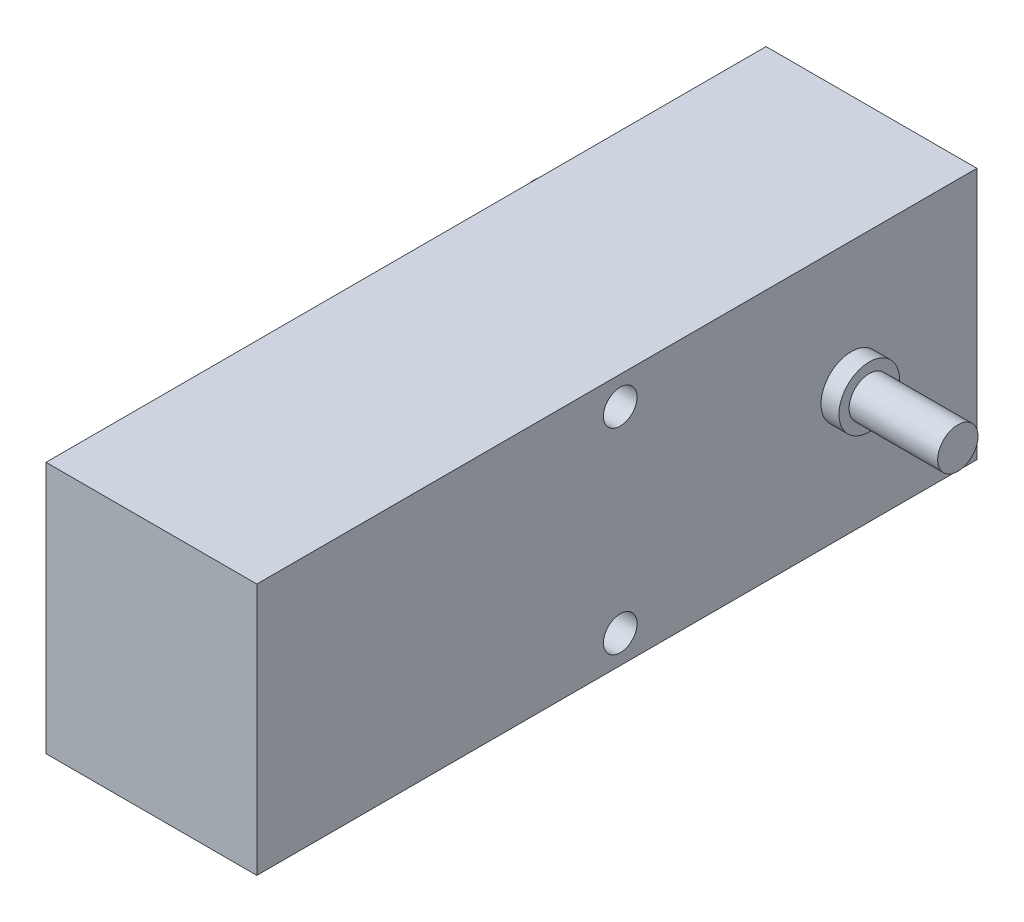
from build123d import *

# Parameters (mm, degrees)
SKETCH1_W               = 64.2
SKETCH1_H               = 22.5
BOSS_EXTRUDE1_DEPTH     = 9.4
SKETCH3_W               = 5
SKETCH3_H               = 5
SKETCH3_R               = 1.4
BOSS_EXTRUDE2_DEPTH     = 2.5
CUT_EXTRUDE1_DEPTH      = 44.129833063
CUT_EXTRUDE1_DEPTH_BACK = 44.129833063
SKETCH4_R               = 1.5


with BuildPart() as part:
    # Sketch1 → Boss-Extrude1 (new, symmetric)
    with BuildSketch(Plane(origin=(0, 0, 0), x_dir=(0, 0, -1), z_dir=(1, 0, 0))):
        Rectangle(SKETCH1_W, SKETCH1_H)
    extrude(amount=BOSS_EXTRUDE1_DEPTH, both=True)

    # Sketch2 → Revolve1 (revolve)
    with BuildSketch(Plane(origin=(0, 0, 0), x_dir=(1, 0, 0), z_dir=(0, 1, 0)), mode=Mode.PRIVATE) as revolve1_sk:
        Polygon((18.9, 20.9), (18.9, 22.7), (11, 22.7), (11, 23.6), (9.4, 23.6), (9.4, 20.9), align=None)
        Polygon((-9.4, 23.6), (-9.4, 20.9), (-18.9, 20.9), (-18.9, 22.7), (-11, 22.7), (-11, 23.6), align=None)
    revolve(revolve1_sk.sketch.rotate(Axis((0, 0, -20.9), (1, 0, 0)), 180), axis=Axis((0, 0, -20.9), (1, 0, 0)))

    # Sketch3 → Boss-Extrude2 (add, symmetric)
    with BuildSketch(Plane(origin=(0, 0, 0), x_dir=(0, 0, -1), z_dir=(1, 0, 0))):
        with Locations((34.6, 0)):
            Rectangle(SKETCH3_W, SKETCH3_H)
        with Locations((34.7, 0)):
            Circle(SKETCH3_R, mode=Mode.SUBTRACT)
    extrude(amount=BOSS_EXTRUDE2_DEPTH, both=True)

    # Sketch4 → Cut-Extrude1 (cut, two sides: drawn at the far end of the back side and taken through both)
    with BuildSketch(Plane(origin=(0, 0, 0), x_dir=(0, 0, -1), z_dir=(1, 0, 0)).offset(-CUT_EXTRUDE1_DEPTH_BACK)):
        with Locations((0.3, 8.75)):
            Circle(SKETCH4_R)
        with Locations((0.3, -8.75)):
            Circle(SKETCH4_R)
    extrude(amount=CUT_EXTRUDE1_DEPTH + CUT_EXTRUDE1_DEPTH_BACK, mode=Mode.SUBTRACT)


solid = part.part
